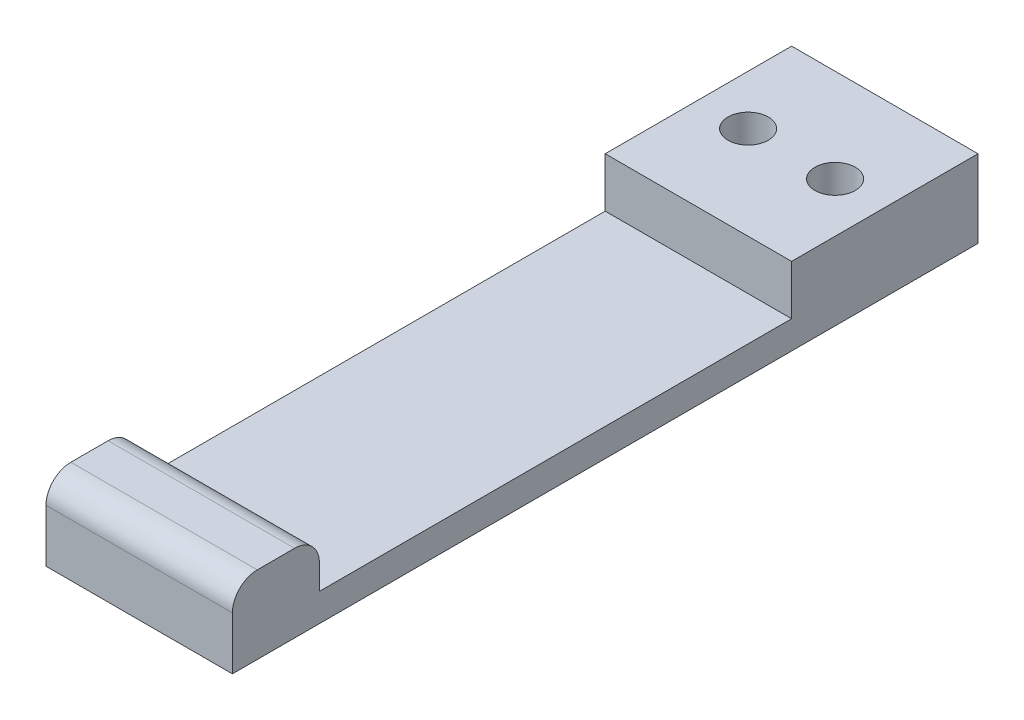
from build123d import *

# Parameters (mm, degrees)
BOSS_EXTRUDE1_DEPTH = 15
SKETCH2_R           = 1.625
CUT_EXTRUDE1_DEPTH  = 6.25


with BuildPart() as part:
    # Sketch1 → Boss-Extrude1 (new body)
    with BuildSketch(Plane(origin=(0, 0, 0), x_dir=(0, 0, -1), z_dir=(1, 0, 0))):
        with BuildLine():
            Line((0, 4.25), (0, 0))
            Line((0, 0), (60, 0))
            Line((60, 0), (60, 6.25))
            Line((60, 6.25), (45, 6.25))
            Line((45, 6.25), (45, 2.25))
            Line((45, 2.25), (7, 2.25))
            Line((7, 2.25), (7, 4.25))
            ThreePointArc((7, 4.25), (6.414213562, 5.664213562), (5, 6.25))
            Line((5, 6.25), (2, 6.25))
            ThreePointArc((2, 6.25), (0.585786438, 5.664213562), (0, 4.25))
        make_face()
    extrude(amount=BOSS_EXTRUDE1_DEPTH)

    # Sketch2 → Cut-Extrude1 (cut)
    with BuildSketch(Plane.XZ):
        with Locations(Location((11, -52.5, 0), (0, 0, 270))):
            Circle(SKETCH2_R)
        with Locations(Location((4, -52.5, 0), (0, 0, 270))):
            Circle(SKETCH2_R)
    extrude(amount=-CUT_EXTRUDE1_DEPTH, mode=Mode.SUBTRACT)


solid = part.part
